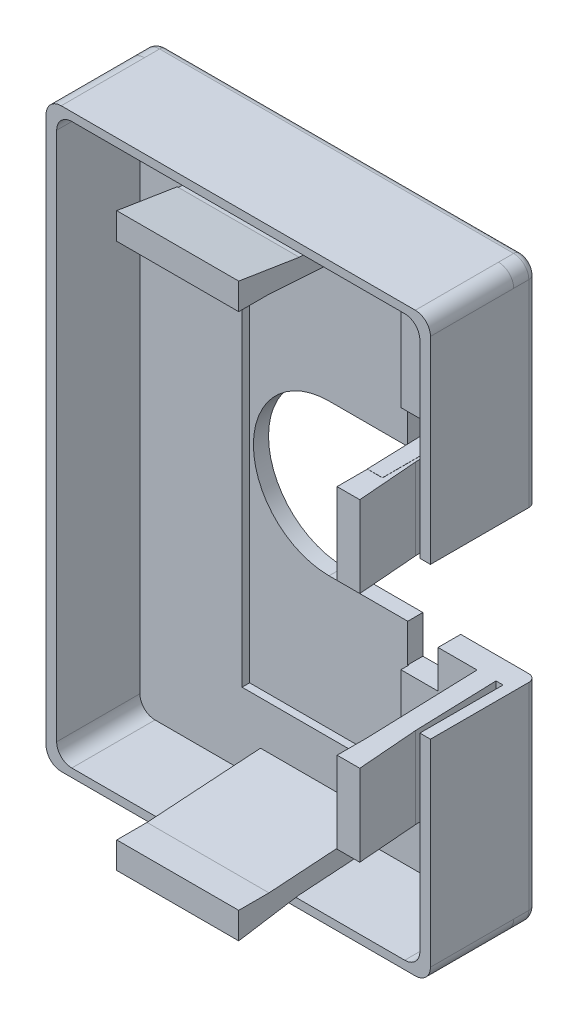
from build123d import *

# Parameters (mm, degrees)
CROQUIS1_W                  = 50.8
CROQUIS1_H                  = 76.2
SALIENTE_EXTRUIR1_DEPTH     = 18
CROQUIS2_W                  = 50.8
CROQUIS2_H                  = 76.2
CROQUIS2_W_2                = 46.12
CROQUIS2_H_2                = 71.52
CROQUIS2_W_3                = 38.8
CROQUIS2_H_3                = 64.2
CORTAR_EXTRUIR1_DEPTH       = 15
CORTAR_EXTRUIR8_DEPTH       = 15
SALIENTE_EXTRUIR3_DEPTH     = 41.5
CORTAR_EXTRUIR9_DEPTH       = 51.5
CORTAR_EXTRUIR10_DEPTH      = 51.5
SALIENTE_EXTRUIR4_DEPTH     = 16
CORTAR_EXTRUIR11_DEPTH      = 16.5
REDONDEO3_R                 = 2
REDONDEO4_R                 = 1
CROQUIS15_W                 = 47.12
CROQUIS15_H                 = 10
CORTAR_EXTRUIR12_DEPTH      = 15
CORTAR_EXTRUIR16_DEPTH      = 49.184749
CORTAR_EXTRUIR16_DEPTH_BACK = 49.184749
CROQUIS18_R                 = 10
CROQUIS18_W                 = 2.5
CROQUIS18_H                 = 4.99
CROQUIS18_H_2               = 5.01
CROQUIS19_W                 = 5
CROQUIS19_H                 = 5
CORTAR_EXTRUIR17_DEPTH      = 49.184749
CROQUIS20_W                 = 50.8
CROQUIS20_H                 = 76.2
CROQUIS20_W_2               = 48
CROQUIS20_H_2               = 74
SALIENTE_EXTRUIR5_DEPTH     = 11
CROQUIS21_W                 = 25
CROQUIS21_H                 = 20
CORTAR_EXTRUIR18_DEPTH      = 10
CROQUIS22_W                 = 21
CROQUIS22_H                 = 55
CORTAR_EXTRUIR19_DEPTH      = 1
REDONDEO5_R                 = 2
CROQUIS23_W                 = 2.5
CROQUIS23_H                 = 15.754868
CROQUIS23_H_2               = 15.75
CROQUIS23_H_3               = 10.74
CROQUIS23_W_2               = 16.125604
CROQUIS23_H_4               = 2.502437
CROQUIS23_W_3               = 16.12
CROQUIS23_H_5               = 2.5
CROQUIS23_H_6               = 10.76
SALIENTE_EXTRUIR6_DEPTH     = 4
CROQUIS24_W                 = 3
CROQUIS24_H                 = 15.77
CROQUIS24_H_2               = 15.75
CORTAR_EXTRUIR20_DEPTH      = 19
SALIENTE_EXTRUIR7_DEPTH     = 10.74
SALIENTE_EXTRUIR8_DEPTH     = 10.76
SALIENTE_EXTRUIR9_REACH     = 57.274
SALIENTE_EXTRUIR10_REACH    = 57.274


with BuildPart() as part:
    # Croquis1 → Saliente-Extruir1 (new body)
    with BuildSketch(Plane.XY):
        Rectangle(CROQUIS1_W, CROQUIS1_H)
    extrude(amount=SALIENTE_EXTRUIR1_DEPTH)

    # Croquis2 → Cortar-Extruir1 (cut)
    # profile 1 of 2: a face of its own
    with BuildSketch(Plane.XY.offset(18)):
        Rectangle(CROQUIS2_W, CROQUIS2_H)
        Rectangle(CROQUIS2_W_2, CROQUIS2_H_2, mode=Mode.SUBTRACT)
    # profile 2 of 2: a face of its own
    with BuildSketch(Plane.XY.offset(18)):
        Rectangle(CROQUIS2_W_3, CROQUIS2_H_3)
    extrude(amount=-CORTAR_EXTRUIR1_DEPTH, mode=Mode.SUBTRACT)

    # Croquis6 → Cortar-Extruir8 (cut)
    with BuildSketch(Plane.XY.offset(18)):
        Polygon((-23.06, 35.76), (-8.06, 35.76), (-8.06, 32.1), (-19.4, 32.1), (-19.4, 20.76), (-23.06, 20.76), align=None)
        Polygon((23.06, 35.76), (8.06, 35.76), (8.06, 32.1), (19.4, 32.1), (19.4, 20.76), (23.06, 20.76), align=None)
        Polygon((-23.06, -35.76), (-23.06, -20.76), (-19.4, -20.76), (-19.4, -32.1), (-8.06, -32.1), (-8.06, -35.76), align=None)
        Polygon((23.06, -35.76), (8.06, -35.76), (8.06, -32.1), (19.4, -32.1), (19.4, -20.76), (23.06, -20.76), align=None)
    extrude(amount=-CORTAR_EXTRUIR8_DEPTH, mode=Mode.SUBTRACT)

    # Croquis10 → Saliente-Extruir3 (add)
    with BuildSketch(Plane(origin=(0, -20.76, 0), x_dir=(-1, 0, 0), z_dir=(0, -1, 0))):
        Polygon((23.06, -18), (23.56, -18), (23.06, -3), align=None)
        Polygon((-23.06, -18), (-23.56, -18), (-23.06, -3), align=None)
    extrude(amount=-SALIENTE_EXTRUIR3_DEPTH)

    # Croquis11 → Cortar-Extruir9 (cut)
    with BuildSketch(Plane.XZ.offset(20.76)):
        Polygon((-19.4, 18), (-21.06, 18), (-20.56, 3), (-19.4, 3), align=None)
    extrude(amount=-CORTAR_EXTRUIR9_DEPTH, mode=Mode.SUBTRACT)

    # Croquis12 → Cortar-Extruir10 (cut)
    with BuildSketch(Plane.XZ.offset(20.76)):
        Polygon((19.4, 18), (19.4, 3), (20.56, 3), (21.06, 18), align=None)
    extrude(amount=-CORTAR_EXTRUIR10_DEPTH, mode=Mode.SUBTRACT)

    # Croquis13 → Saliente-Extruir4 (add)
    with BuildSketch(Plane(origin=(8.06, 0, 0), x_dir=(0, 0, -1), z_dir=(1, 0, 0))):
        Polygon((-18, -35.76), (-18, -36.76), (-3, -35.76), align=None)
        Polygon((-18, 35.76), (-18, 36.76), (-3, 35.76), align=None)
    extrude(amount=-SALIENTE_EXTRUIR4_DEPTH)

    # Croquis14 → Cortar-Extruir11 (cut)
    with BuildSketch(Plane(origin=(8.06, 0, 0), x_dir=(0, 0, -1), z_dir=(1, 0, 0))):
        Polygon((-3, -32.1), (-18, -32.1), (-18, -34.26), (-3, -33.26), align=None)
        Polygon((-18, 32.1), (-18, 34.26), (-3, 33.26), (-3, 32.1), align=None)
    extrude(amount=-CORTAR_EXTRUIR11_DEPTH, mode=Mode.SUBTRACT)

    # Redondeo3
    redondeo3_edges = [part.edges().sort_by_distance(p)[0] for p in [
        (-25.4, 38.1, 1.5),
        (25.4, 38.1, 1.5),
        (25.4, -38.1, 1.5),
        (-25.4, -38.1, 1.5),
    ]]
    fillet(redondeo3_edges, radius=REDONDEO3_R)

    # Redondeo4
    redondeo4_edges = [part.edges().sort_by_distance(p)[0] for p in [
        (0, 38.1, 0),
        (-25.4, 0, 0),
        (25.4, 0, 0),
        (0, -38.1, 0),
        (24.814214, -37.514214, 0),
        (-24.814214, -37.514214, 0),
        (-24.814214, 37.514214, 0),
        (24.814214, 37.514214, 0),
    ]]
    fillet(redondeo4_edges, radius=REDONDEO4_R)

    # Croquis15 → Cortar-Extruir12 (cut)
    with BuildSketch(Plane.XY.offset(18)):
        with Locations((0, -0.01)):
            Rectangle(CROQUIS15_W, CROQUIS15_H)
    extrude(amount=-CORTAR_EXTRUIR12_DEPTH, mode=Mode.SUBTRACT)

    # Croquis18 → Cortar-Extruir16 (cut, two sides: drawn at the far end of the back side and taken through both)
    with BuildSketch(Plane.XY.offset(3).offset(-CORTAR_EXTRUIR16_DEPTH_BACK)):
        Circle(CROQUIS18_R)
        with Locations((21.81, -7.505)):
            Rectangle(CROQUIS18_W, CROQUIS18_H)
        with Locations((21.81, 7.495)):
            Rectangle(CROQUIS18_W, CROQUIS18_H_2)
        with BuildLine():
            Line((20.56, 10), (0, 10))
            ThreePointArc((0, 10), (7.071068, 7.071068), (10, 0))
            ThreePointArc((10, 0), (7.071068, -7.071068), (0, -10))
            Line((0, -10), (20.56, -10))
            Line((20.56, -10), (20.56, -5.01))
            Line((20.56, -5.01), (23.06, -5.01))
            Line((23.06, -5.01), (23.06, -10))
            Line((23.06, -10), (25.4, -10))
            Line((25.4, -10), (25.4, 10))
            Line((25.4, 10), (23.06, 10))
            Line((23.06, 10), (23.06, 4.99))
            Line((23.06, 4.99), (20.56, 4.99))
            Line((20.56, 4.99), (20.56, 10))
        make_face()
    extrude(amount=CORTAR_EXTRUIR16_DEPTH + CORTAR_EXTRUIR16_DEPTH_BACK, mode=Mode.SUBTRACT)

    # Croquis19 → Cortar-Extruir17 (cut, through all)
    with BuildSketch(Plane.XY.offset(3)):
        with Locations((12.9, 12.5)):
            Rectangle(CROQUIS19_W, CROQUIS19_H)
        with Locations((12.9, -12.5)):
            Rectangle(CROQUIS19_W, CROQUIS19_H)
    extrude(amount=-CORTAR_EXTRUIR17_DEPTH, mode=Mode.SUBTRACT)

    # Croquis20 → Saliente-Extruir5 (add)
    with BuildSketch(Plane.XY.offset(3)):
        Rectangle(CROQUIS20_W, CROQUIS20_H)
        Rectangle(CROQUIS20_W_2, CROQUIS20_H_2, mode=Mode.SUBTRACT)
    extrude(amount=SALIENTE_EXTRUIR5_DEPTH)

    # Croquis21 → Cortar-Extruir18 (cut)
    with BuildSketch(Plane(origin=(25.4, 0, 0), x_dir=(0, 0, -1), z_dir=(1, 0, 0))):
        with Locations((-15.5, 0)):
            Rectangle(CROQUIS21_W, CROQUIS21_H)
    extrude(amount=-CORTAR_EXTRUIR18_DEPTH, mode=Mode.SUBTRACT)

    # Croquis22 → Cortar-Extruir19 (cut)
    with BuildSketch(Plane.XY.offset(3)):
        Rectangle(CROQUIS22_W, CROQUIS22_H)
    extrude(amount=-CORTAR_EXTRUIR19_DEPTH, mode=Mode.SUBTRACT)

    # Redondeo5
    redondeo5_edges = [part.edges().sort_by_distance(p)[0] for p in [
        (25.4, -38.1, 8.5),
        (-25.4, -38.1, 8.5),
        (-25.4, 38.1, 8.5),
        (25.4, 38.1, 8.5),
        (-24, 37, 8.5),
        (-24, -37, 8.5),
        (24, -37, 8.5),
        (24, 37, 8.5),
    ]]
    fillet(redondeo5_edges, radius=REDONDEO5_R)

    # Croquis23 → Saliente-Extruir6 (add)
    with BuildSketch(Plane.XY.offset(18)):
        with Locations((-22.31, 12.882566)):
            Rectangle(CROQUIS23_W, CROQUIS23_H)
        with Locations((-22.31, -12.885)):
            Rectangle(CROQUIS23_W, CROQUIS23_H_2)
        with Locations((22.31, 15.37)):
            Rectangle(CROQUIS23_W, CROQUIS23_H_3)
        with Locations((-0.002802, 35.511218)):
            Rectangle(CROQUIS23_W_2, CROQUIS23_H_4)
        with Locations((0, -35.51)):
            Rectangle(CROQUIS23_W_3, CROQUIS23_H_5)
        with Locations((22.31, -15.38)):
            Rectangle(CROQUIS23_W, CROQUIS23_H_6)
    extrude(amount=SALIENTE_EXTRUIR6_DEPTH)

    # Croquis24 → Cortar-Extruir20 (cut)
    with BuildSketch(Plane.XY.offset(22)):
        with Locations((-22.06, 12.875)):
            Rectangle(CROQUIS24_W, CROQUIS24_H)
        with Locations((-22.06, -12.885)):
            Rectangle(CROQUIS24_W, CROQUIS24_H_2)
    extrude(amount=-CORTAR_EXTRUIR20_DEPTH, mode=Mode.SUBTRACT)

    # Croquis25 → Saliente-Extruir7 (add)
    with BuildSketch(Plane(origin=(0, 20.74, 0), x_dir=(1, 0, 0), z_dir=(0, 1, 0))):
        Polygon((23.56, -22), (24.06, -22), (23.426667, -14), align=None)
    extrude(amount=-SALIENTE_EXTRUIR7_DEPTH)

    # Croquis26 → Saliente-Extruir8 (add)
    with BuildSketch(Plane.XZ.offset(20.76)):
        Polygon((23.56, 22), (23.426667, 14), (24.06, 22), align=None)
    extrude(amount=-SALIENTE_EXTRUIR8_DEPTH)

    # Saliente-Extruir9: up to this face of the body (flat: up to its plane)
    saliente_extruir9_end = Plane(part.part.faces().sort_by_distance((-8.065604, 35.511219, 20))[0])
    # Croquis27 → Saliente-Extruir9 (add, up to the picked face)
    with BuildSketch(Plane(origin=(8.06, 0, 0), x_dir=(0, 0, -1), z_dir=(1, 0, 0)), mode=Mode.PRIVATE) as saliente_extruir9_sk1:
        Polygon((-22, 36.762437), (-22, 37.762437), (-14, 36.494227), (-22, 36.494227), align=None)
    saliente_extruir9_tool1 = split(extrude(saliente_extruir9_sk1.sketch, amount=-SALIENTE_EXTRUIR9_REACH, mode=Mode.PRIVATE), bisect_by=saliente_extruir9_end, keep=Keep.BOTH, mode=Mode.PRIVATE)
    add(saliente_extruir9_tool1.solids().sort_by(Axis((8.06, 36.916964, 19.333333), (-1, 0, 0)))[0])

    # Saliente-Extruir10: up to this face of the body (flat: up to its plane)
    saliente_extruir10_end = Plane(part.part.faces().sort_by_distance((-8.06, -34.931875, 12.40625))[0])
    # Croquis28 → Saliente-Extruir10 (add, up to the picked face)
    with BuildSketch(Plane(origin=(8.06, 0, 0), x_dir=(0, 0, -1), z_dir=(1, 0, 0)), mode=Mode.PRIVATE) as saliente_extruir10_sk1:
        Polygon((-22, -36.76), (-22, -37.76), (-14, -36.49), (-22, -36.49), align=None)
    saliente_extruir10_tool1 = split(extrude(saliente_extruir10_sk1.sketch, amount=-SALIENTE_EXTRUIR10_REACH, mode=Mode.PRIVATE), bisect_by=saliente_extruir10_end, keep=Keep.BOTH, mode=Mode.PRIVATE)
    add(saliente_extruir10_tool1.solids().sort_by(Axis((8.06, -36.913333, 19.333333), (-1, 0, 0)))[0])


solid = part.part
